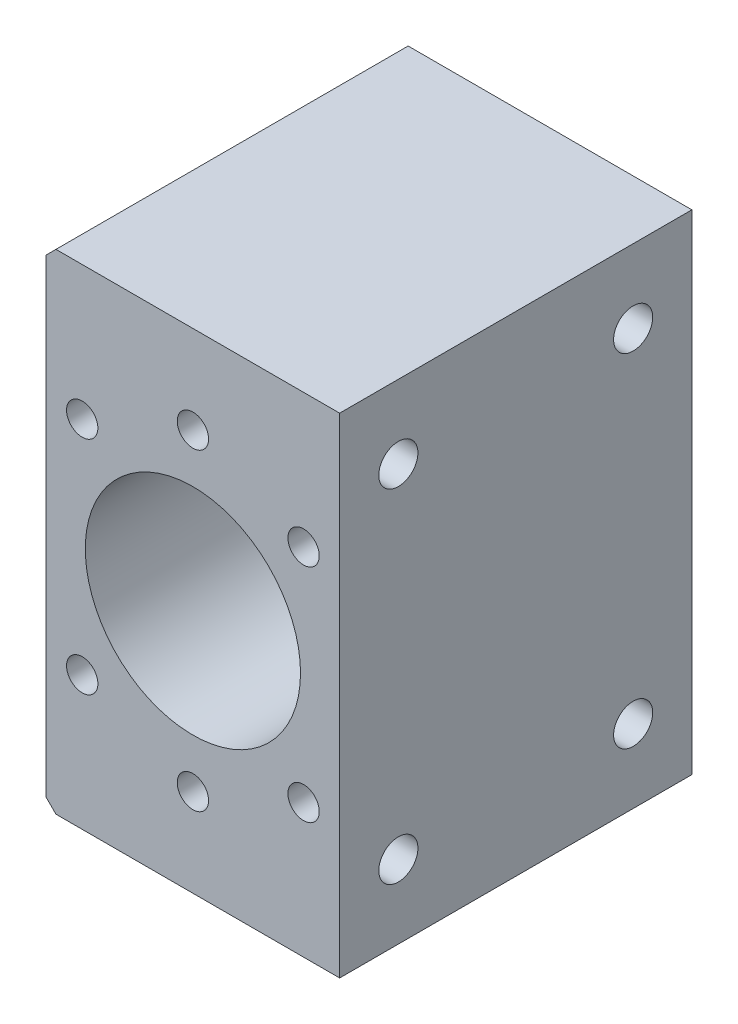
from build123d import *

# Parameters (mm, degrees)
SKETCH_4_R          = 11
EXTRUDE_2_DEPTH     = 36
SKETCH_5_R          = 1.6
CUT_EXTRUDE_2_DEPTH = 10
SKETCH_6_R          = 2
CUT_EXTRUDE_3_DEPTH = 10
SKETCH_9_R          = 1.2
CUT_EXTRUDE_5_DEPTH = 5


with BuildPart() as part:
    # 草图4 → 凸台-拉伸2 (new body)
    with BuildSketch(Plane.XY):
        Polygon((15, 25), (-14, 25), (-15, 24), (-15, -24), (-14, -25), (15, -25), align=None)
        Circle(SKETCH_4_R, mode=Mode.SUBTRACT)
    extrude(amount=EXTRUDE_2_DEPTH)

    # 草图5 → 切除-拉伸2 (cut)
    with BuildSketch(Plane.XY.offset(36)):
        with Locations((0, 16)):
            Circle(SKETCH_5_R)
        with Locations((11.313708499, 11.313708499)):
            Circle(SKETCH_5_R)
        with Locations((11.313708499, -11.313708499)):
            Circle(SKETCH_5_R)
        with Locations((0, -16)):
            Circle(SKETCH_5_R)
        with Locations((-11.313708499, -11.313708499)):
            Circle(SKETCH_5_R)
        with Locations((-11.313708499, 11.313708499)):
            Circle(SKETCH_5_R)
    extrude(amount=-CUT_EXTRUDE_2_DEPTH, mode=Mode.SUBTRACT)

    # 草图6 → 切除-拉伸3 (cut)
    with BuildSketch(Plane(origin=(15, 0, 0), x_dir=(0, 0, -1), z_dir=(1, 0, 0))):
        with Locations((-6, 17.5)):
            Circle(SKETCH_6_R)
        with Locations((-30, 17.5)):
            Circle(SKETCH_6_R)
        with Locations((-30, -17.5)):
            Circle(SKETCH_6_R)
        with Locations((-6, -17.5)):
            Circle(SKETCH_6_R)
    extrude(amount=-CUT_EXTRUDE_3_DEPTH, mode=Mode.SUBTRACT)

    # 草图9 → 切除-拉伸5 (cut)
    with BuildSketch(Plane.ZY.offset(15)):
        with Locations((6, 17.5)):
            Circle(SKETCH_9_R)
        with Locations((30, 17.5)):
            Circle(SKETCH_9_R)
        with Locations((6, -17.5)):
            Circle(SKETCH_9_R)
        with Locations((30, -17.5)):
            Circle(SKETCH_9_R)
    extrude(amount=-CUT_EXTRUDE_5_DEPTH, mode=Mode.SUBTRACT)


solid = part.part
